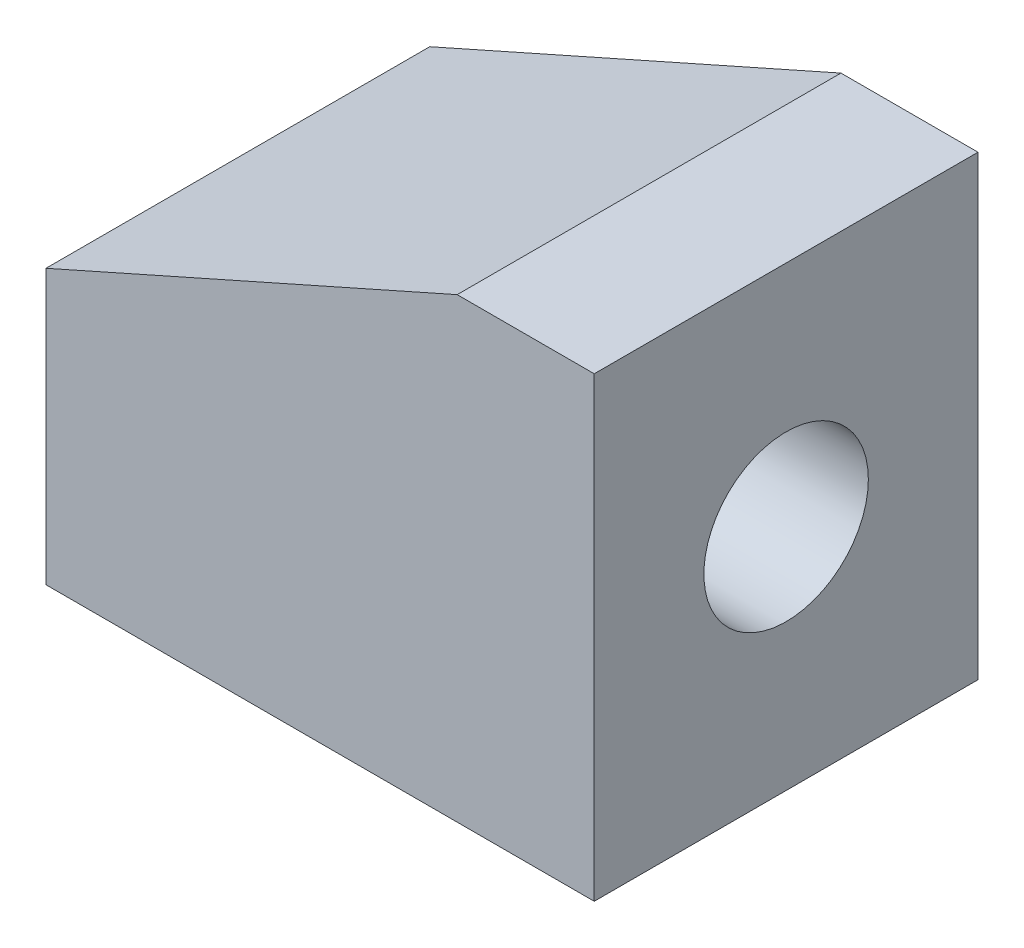
from build123d import *

# Parameters (mm, degrees)
Y_KSEKLIK_EKSTR_ZYON1_DEPTH = 42
IZIM2_R                     = 9
KES_EKSTR_ZYON1_DEPTH       = 40


with BuildPart() as part:
    # Çizim1 → Yükseklik-Ekstrüzyon1 (new body)
    with BuildSketch(Plane.XY):
        Polygon((-81.502189773, 17.148876404), (-81.502189773, -12.851123596), (-21.502189773, -12.851123596), (-21.502189773, 37.148876404), (-36.502189773, 37.148876404), align=None)
    extrude(amount=Y_KSEKLIK_EKSTR_ZYON1_DEPTH)

    # Çizim2 → Kes-Ekstrüzyon1 (cut)
    with BuildSketch(Plane(origin=(-21.502189773, 0, 0), x_dir=(0, 0, -1), z_dir=(1, 0, 0))):
        with Locations((-21, 12.148876404)):
            Circle(IZIM2_R)
    extrude(amount=-KES_EKSTR_ZYON1_DEPTH, mode=Mode.SUBTRACT)


solid = part.part
